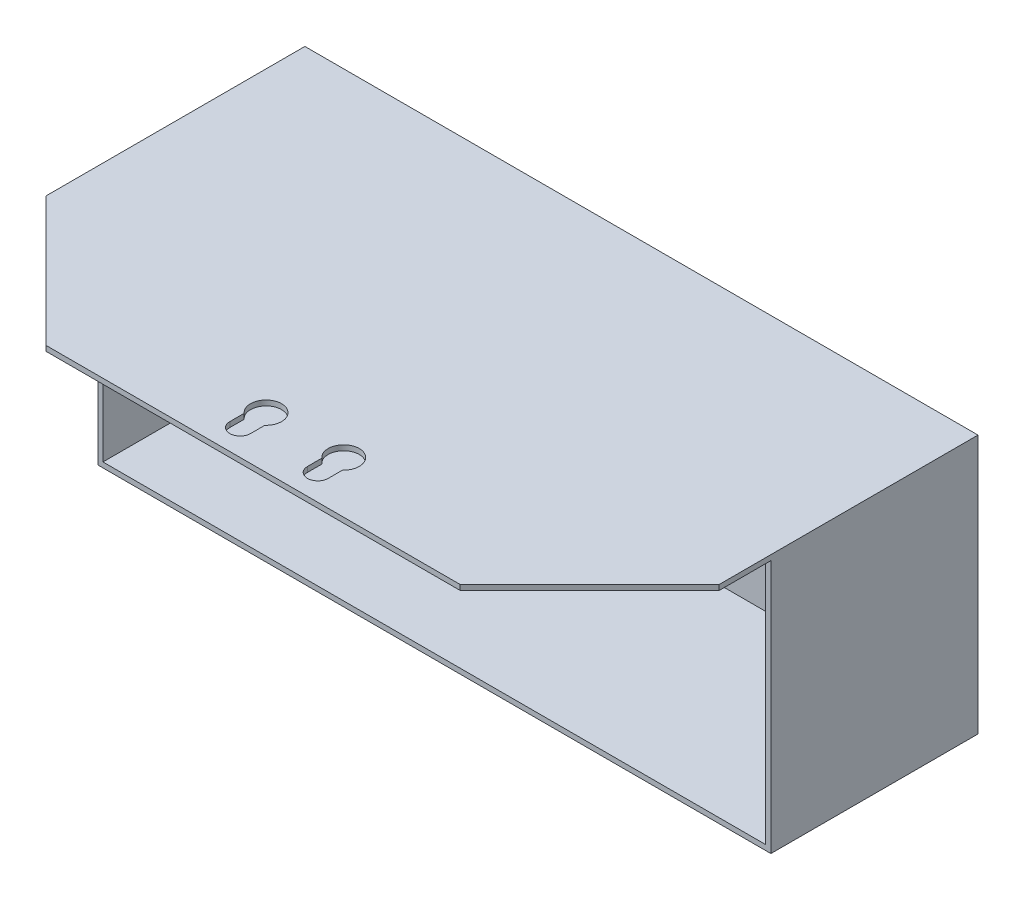
from build123d import *

# Parameters (mm, degrees)
SKETCH_1_W          = 260
SKETCH_1_H          = 100
EXTRUDE_1_DEPTH     = 80
SHELL_1_T           = -2
SKETCH_4_W          = 260
SKETCH_4_H          = 70
EXTRUDE_1_2_DEPTH   = 2
CUT_EXTRUDE_3_DEPTH = 10
CHAMFER_1_SIZE      = 50


with BuildPart() as part:
    # 草图1 → Extrude 1 (new body)
    with BuildSketch(Plane.XY):
        with Locations((130, 50)):
            Rectangle(SKETCH_1_W, SKETCH_1_H)
    extrude(amount=EXTRUDE_1_DEPTH)

    # 抽壳1
    shell_1_openings = [part.faces().sort_by_distance(p)[0] for p in [
        (130, 50, 80),
    ]]
    offset(amount=SHELL_1_T, openings=shell_1_openings, kind=Kind.INTERSECTION)

    # 草图4 → Extrude 1 2 (add)
    with BuildSketch(Plane(origin=(0, 100, 0), x_dir=(1, 0, 0), z_dir=(0, 1, 0))):
        with Locations((130, -115)):
            Rectangle(SKETCH_4_W, SKETCH_4_H)
    extrude(amount=-EXTRUDE_1_2_DEPTH)

    # 草图5 → 切除-拉伸3 (cut)
    with BuildSketch(Plane(origin=(0, 98, 0), x_dir=(-1, 0, 0), z_dir=(0, -1, 0))):
        with BuildLine():
            Line((-119, -140), (-119, -134.472135955))
            ThreePointArc((-119, -134.472135955), (-115, -124), (-111, -134.472135955))
            Line((-111, -134.472135955), (-111, -140))
            ThreePointArc((-111, -140), (-115, -144), (-119, -140))
        make_face()
        with BuildLine():
            Line((-149, -140), (-149, -134.472135955))
            ThreePointArc((-149, -134.472135955), (-145, -124), (-141, -134.472135955))
            Line((-141, -134.472135955), (-141, -140))
            ThreePointArc((-141, -140), (-145, -144), (-149, -140))
        make_face()
    extrude(amount=-CUT_EXTRUDE_3_DEPTH, mode=Mode.SUBTRACT)

    # 倒角1
    chamfer_1_edges = [part.edges().sort_by_distance(p)[0] for p in [
        (260, 99, 150),
        (0, 99, 150),
    ]]
    chamfer(chamfer_1_edges, length=CHAMFER_1_SIZE)


solid = part.part
